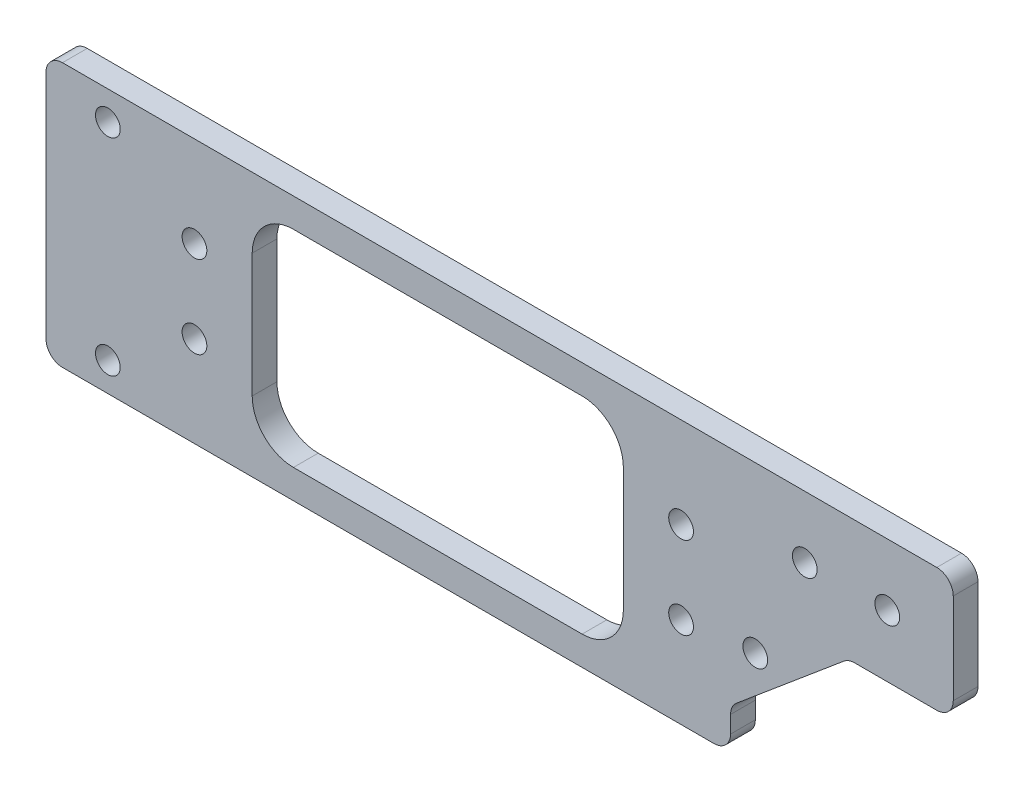
from build123d import *

# Parameters (mm, degrees)
SKETCH_1_R      = 1.5
SKETCH_1_W      = 45
SKETCH_1_H      = 25
EXTRUDE_1_DEPTH = 3
FILLET_1_R      = 2
FILLET_2_R      = 5


with BuildPart() as part:
    # 草图1 → 凸台-拉伸1 (new body)
    with BuildSketch(Plane.XY):
        Polygon((-47.5, 16), (-47.5, -16), (35.5, -16), (35.5, -11), (49.801043111, 1), (62.5, 1), (62.5, 16), (35.5, 16), align=None)
        with Locations((-29.5, 5)):
            Circle(SKETCH_1_R, mode=Mode.SUBTRACT)
        with Locations((-29.5, -5)):
            Circle(SKETCH_1_R, mode=Mode.SUBTRACT)
        with Locations((29.5, 5)):
            Circle(SKETCH_1_R, mode=Mode.SUBTRACT)
        with Locations((29.5, -5)):
            Circle(SKETCH_1_R, mode=Mode.SUBTRACT)
        with Locations((44.5, 8.5)):
            Circle(SKETCH_1_R, mode=Mode.SUBTRACT)
        with Locations((54.5, 8.5)):
            Circle(SKETCH_1_R, mode=Mode.SUBTRACT)
        with Locations((-40, 12.5)):
            Circle(SKETCH_1_R, mode=Mode.SUBTRACT)
        with Locations(Location((-40, -12.5, 0), (0, 0, 180))):
            Circle(SKETCH_1_R, mode=Mode.SUBTRACT)
        with Locations((38.5, -4)):
            Circle(SKETCH_1_R, mode=Mode.SUBTRACT)
        Rectangle(SKETCH_1_W, SKETCH_1_H, mode=Mode.SUBTRACT)
    extrude(amount=EXTRUDE_1_DEPTH)

    # 圆角1
    fillet_1_edges = [part.edges().sort_by_distance(p)[0] for p in [
        (62.5, 16, 1.5),
        (62.5, 1, 1.5),
        (49.801043111, 1, 1.5),
        (35.5, -11, 1.5),
        (35.5, -16, 1.5),
        (-47.5, -16, 1.5),
        (-47.5, 16, 1.5),
    ]]
    fillet(fillet_1_edges, radius=FILLET_1_R)

    # 圆角2
    fillet_2_edges = [part.edges().sort_by_distance(p)[0] for p in [
        (22.5, -12.5, 1.5),
        (22.5, 12.5, 1.5),
        (-22.5, 12.5, 1.5),
        (-22.5, -12.5, 1.5),
    ]]
    fillet(fillet_2_edges, radius=FILLET_2_R)


solid = part.part
